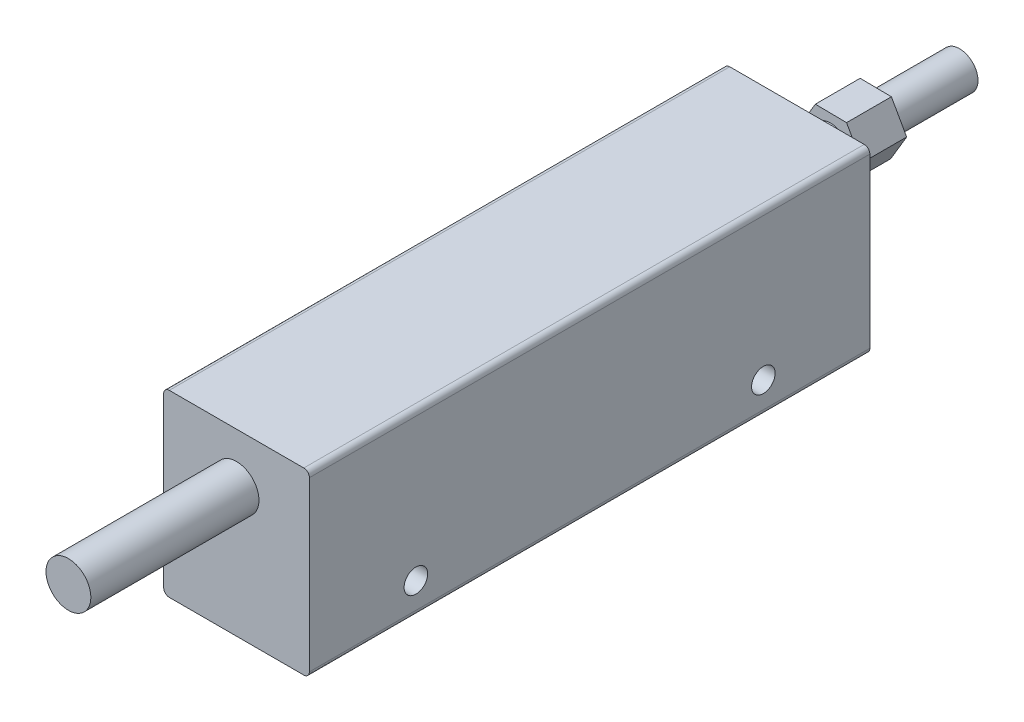
from build123d import *

# Parameters (mm, degrees)
SKETCH1_W           = 13
SKETCH1_H           = 16
BOSS_EXTRUDE1_DEPTH = 50
SKETCH2_R           = 1.05
CUT_EXTRUDE1_DEPTH  = 55.083269132
SKETCH3_R           = 2
BOSS_EXTRUDE2_DEPTH = 15
SKETCH4_R           = 1.65
BOSS_EXTRUDE3_DEPTH = 14.5
FILLET1_R           = 0.5
BOSS_EXTRUDE4_START = -7.5
BOSS_EXTRUDE4_DEPTH = 4


with BuildPart() as part:
    # Sketch1 → Boss-Extrude1 (new body)
    with BuildSketch(Plane.XY):
        with Locations((6.5, 8)):
            Rectangle(SKETCH1_W, SKETCH1_H)
    extrude(amount=BOSS_EXTRUDE1_DEPTH)

    # Sketch2 → Cut-Extrude1 (cut, through all)
    with BuildSketch(Plane(origin=(13, 0, 0), x_dir=(0, 0, -1), z_dir=(1, 0, 0))):
        with Locations(Location((-40.5, 2.8, 0), (0, 0, 90))):
            Circle(SKETCH2_R)
        with Locations(Location((-9.5, 2.8, 0), (0, 0, 90))):
            Circle(SKETCH2_R)
    extrude(amount=-CUT_EXTRUDE1_DEPTH, mode=Mode.SUBTRACT)

    # Sketch3 → Boss-Extrude2 (add)
    with BuildSketch(Plane.XY.offset(50)):
        with Locations(Location((6.5, 11.5, 0), (0, 0, 180))):
            Circle(SKETCH3_R)
    extrude(amount=BOSS_EXTRUDE2_DEPTH)

    # Sketch4 → Boss-Extrude3 (add)
    with BuildSketch(Plane(origin=(0, 0, 0), x_dir=(-1, 0, 0), z_dir=(0, 0, -1))):
        with Locations(Location((-6.5, 11.5, 0), (0, 0, 180))):
            Circle(SKETCH4_R)
    extrude(amount=BOSS_EXTRUDE3_DEPTH)

    # Fillet1
    fillet1_edges = [part.edges().sort_by_distance(p)[0] for p in [
        (0, 16, 25),
        (13, 16, 25),
        (13, 0, 25),
        (0, 0, 25),
    ]]
    fillet(fillet1_edges, radius=FILLET1_R)

    # Sketch6 → Boss-Extrude4 (add)
    with BuildSketch(Plane(origin=(0, 0, -14.5), x_dir=(-1, 0, 0), z_dir=(0, 0, -1)).offset(BOSS_EXTRUDE4_START)):
        Polygon((-7.86221417, 9.070311134), (-5.076934804, 9.10544349), (-3.714720633, 11.535132356), (-5.13778583, 13.929688866), (-7.923065196, 13.89455651), (-9.285279367, 11.464867644), align=None)
    extrude(amount=-BOSS_EXTRUDE4_DEPTH)


solid = part.part
